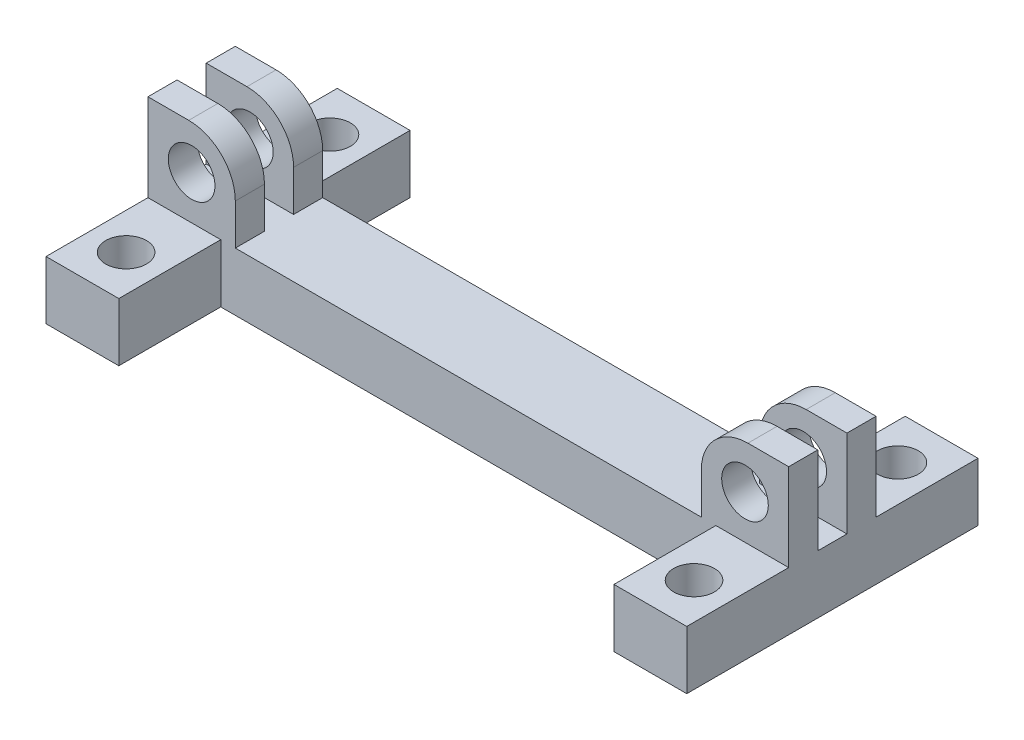
from build123d import *

# Parameters (mm, degrees)
SKETCH1_R           = 2.032
BOSS_EXTRUDE1_DEPTH = 7.62
SKETCH3_W           = 2.54
SKETCH3_H           = 7.62
CUT_EXTRUDE1_DEPTH  = 55.88
SKETCH5_W           = 6.35
SKETCH5_H           = 8.89
SKETCH5_R           = 1.778
BOSS_EXTRUDE2_DEPTH = 5.08
FILLET2_R           = 4.064


with BuildPart() as part:
    # Sketch1 → Boss-Extrude1 (new body)
    with BuildSketch(Plane.XY):
        Polygon((0, 0), (0, 12.7), (7.62, 12.7), (7.62, 5.08), (48.26, 5.08), (48.26, 12.7), (55.88, 12.7), (55.88, 0), align=None)
        with Locations((3.81, 8.89)):
            Circle(SKETCH1_R, mode=Mode.SUBTRACT)
        with Locations((52.07, 8.89)):
            Circle(SKETCH1_R, mode=Mode.SUBTRACT)
    extrude(amount=-BOSS_EXTRUDE1_DEPTH)

    # Sketch3 → Cut-Extrude1 (cut)
    with BuildSketch(Plane(origin=(55.88, 0, 0), x_dir=(0, 0, -1), z_dir=(1, 0, 0))):
        with Locations((3.81, 8.89)):
            Rectangle(SKETCH3_W, SKETCH3_H)
    extrude(amount=-CUT_EXTRUDE1_DEPTH, mode=Mode.SUBTRACT)

    # Sketch5 → Boss-Extrude2 (add)
    # profile 1 of 4: a face of its own
    with BuildSketch(Plane(origin=(0, 0, 0), x_dir=(1, 0, 0), z_dir=(0, 1, 0))):
        with Locations((52.705, 12.065)):
            Rectangle(SKETCH5_W, SKETCH5_H)
        with Locations(Location((52.705, 12.7, 0), (0, 0, 270))):
            Circle(SKETCH5_R, mode=Mode.SUBTRACT)
    # profile 2 of 4: a face of its own
    with BuildSketch(Plane(origin=(0, 0, 0), x_dir=(1, 0, 0), z_dir=(0, 1, 0))):
        with Locations((52.705, -4.445)):
            Rectangle(SKETCH5_W, SKETCH5_H)
        with Locations(Location((52.705, -5.08, 0), (0, 0, 270))):
            Circle(SKETCH5_R, mode=Mode.SUBTRACT)
    # profile 3 of 4: a face of its own
    with BuildSketch(Plane(origin=(0, 0, 0), x_dir=(1, 0, 0), z_dir=(0, 1, 0))):
        with Locations((3.175, -4.445)):
            Rectangle(SKETCH5_W, SKETCH5_H)
        with Locations(Location((3.175, -5.08, 0), (0, 0, 270))):
            Circle(SKETCH5_R, mode=Mode.SUBTRACT)
    # profile 4 of 4: a face of its own
    with BuildSketch(Plane(origin=(0, 0, 0), x_dir=(1, 0, 0), z_dir=(0, 1, 0))):
        with Locations((3.175, 12.065)):
            Rectangle(SKETCH5_W, SKETCH5_H)
        with Locations(Location((3.175, 12.7, 0), (0, 0, 270))):
            Circle(SKETCH5_R, mode=Mode.SUBTRACT)
    extrude(amount=BOSS_EXTRUDE2_DEPTH)

    # Fillet2
    fillet2_edges = [part.edges().sort_by_distance(p)[0] for p in [
        (7.62, 12.7, -6.35),
        (48.26, 12.7, -6.35),
        (48.26, 12.7, -1.27),
        (7.62, 12.7, -1.27),
    ]]
    fillet(fillet2_edges, radius=FILLET2_R)


solid = part.part
